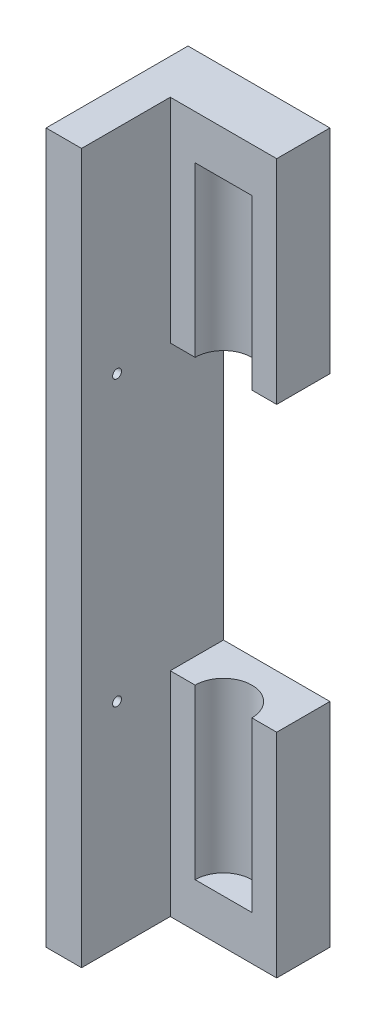
from build123d import *

# Parameters (mm, degrees)
EXTRUDE_2_DEPTH     = 200
SKETCH_3_R          = 8
CUT_EXTRUDE_1_DEPTH = 175
SKETCH_4_W          = 30
SKETCH_4_H          = 15
CUT_EXTRUDE_2_DEPTH = 80
HOLE_WIZARD_M3_1_D  = 2.5


with BuildPart() as part:
    # 草图1 → 凸台-拉伸2 (new body)
    with BuildSketch(Plane(origin=(0, 0, 0), x_dir=(1, 0, 0), z_dir=(0, 1, 0))):
        Polygon((0, 0), (0, -25), (-10, -25), (-10, 15), (30, 15), (30, 0), align=None)
    extrude(amount=EXTRUDE_2_DEPTH)

    # 草图3 → 切除-拉伸1 (cut)
    with BuildSketch(Plane(origin=(0, 187.5, 0), x_dir=(1, 0, 0), z_dir=(0, 1, 0))):
        with Locations((15, 0)):
            Circle(SKETCH_3_R)
    extrude(amount=-CUT_EXTRUDE_1_DEPTH, mode=Mode.SUBTRACT)

    # 草图4 → 切除-拉伸2 (cut)
    with BuildSketch(Plane(origin=(0, 140, 0), x_dir=(1, 0, 0), z_dir=(0, 1, 0))):
        with Locations((15, 7.5)):
            Rectangle(SKETCH_4_W, SKETCH_4_H)
    extrude(amount=-CUT_EXTRUDE_2_DEPTH, mode=Mode.SUBTRACT)

    # M3 螺纹孔1 (through all)
    with Locations(Plane(origin=(0, 0, 0), x_dir=(0, 0, -1), z_dir=(1, 0, 0))):
        with Locations((-15, 140), (-15, 60)):
            Hole(HOLE_WIZARD_M3_1_D / 2)


solid = part.part
